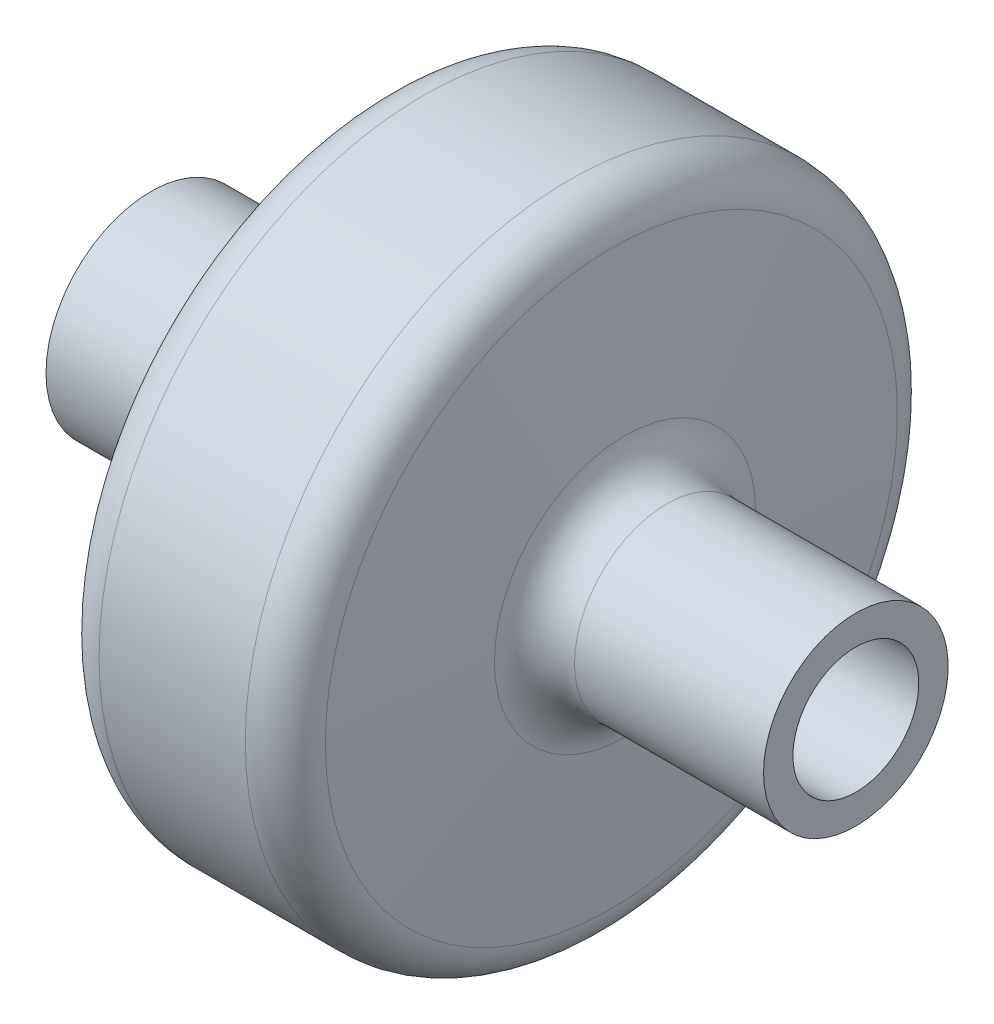
from build123d import *


with BuildPart() as part:
    # Sketch1 → Revolve1 (revolve)
    with BuildSketch(Plane.XY):
        with BuildLine():
            Line((-6.532882959, 36.65), (6.532882959, 36.65))
            ThreePointArc((6.532882959, 36.65), (10.068416865, 35.185533906), (11.532882959, 31.65))
            Line((11.532882959, 31.65), (11.532882959, 7.5))
            Line((11.532882959, 7.5), (43.058183225, 7.5))
            Line((43.058183225, 7.5), (43.058183225, 11))
            Line((43.058183225, 11), (20.533600376, 11))
            ThreePointArc((20.533600376, 11), (17.155649337, 12.313613316), (15.552626885, 15.564221286))
            Line((15.552626885, 15.564221286), (13.932200579, 34.085778714))
            ThreePointArc((13.932200579, 34.085778714), (12.329178127, 37.336386684), (8.951227089, 38.65))
            Line((8.951227089, 38.65), (-8.47182339, 38.65))
            ThreePointArc((-8.47182339, 38.65), (-11.849774428, 37.336386684), (-13.452796881, 34.085778714))
            Line((-13.452796881, 34.085778714), (-15.073223186, 15.564221286))
            ThreePointArc((-15.073223186, 15.564221286), (-16.149423312, 13.381903315), (-18.417233925, 12.5))
            Line((-18.417233925, 12.5), (-40.941816775, 12.5))
            Line((-40.941816775, 12.5), (-40.941816775, 11))
            Line((-40.941816775, 11), (-20.990298017, 11))
            Line((-20.990298017, 11), (-11.532882959, 11))
            Line((-11.532882959, 11), (-11.532882959, 31.65))
            ThreePointArc((-11.532882959, 31.65), (-10.068416865, 35.185533906), (-6.532882959, 36.65))
        make_face()
    revolve(axis=Axis((-39.922119965, 0, 0), (1, 0, 0)))


solid = part.part
